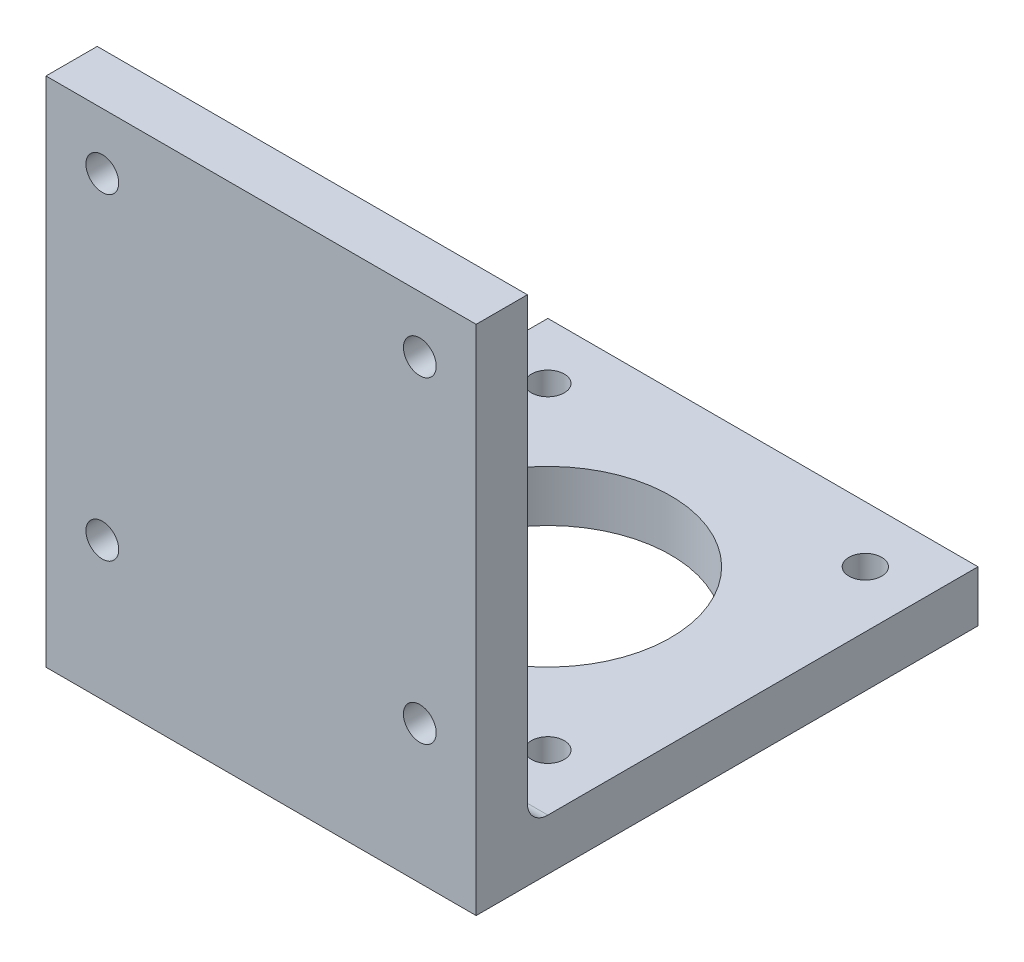
from build123d import *

# Parameters (mm, degrees)
SKETCH_1_R      = 1.6
SKETCH_1_R_2    = 12
EXTRUDE_1_DEPTH = 5
SKETCH_4_W      = 42
SKETCH_4_H      = 50
SKETCH_4_R      = 1.6
EXTRUDE_4_DEPTH = 5
FILLET_1_R      = 2


with BuildPart() as part:
    # 草图1 → 凸台-拉伸1 (new body)
    with BuildSketch(Plane(origin=(0, 0, 0), x_dir=(1, 0, 0), z_dir=(0, 1, 0))):
        Polygon((-21, -21), (-21, 21), (21, 21), (21, -21), (21, -23), (-21, -23), align=None)
        with Locations(Location((-15.5, 15.5, 0), (0, 0, 270))):
            Circle(SKETCH_1_R, mode=Mode.SUBTRACT)
        with Locations(Location((15.5, 15.5, 0), (0, 0, 270))):
            Circle(SKETCH_1_R, mode=Mode.SUBTRACT)
        with Locations(Location((-15.5, -15.5, 0), (0, 0, 270))):
            Circle(SKETCH_1_R, mode=Mode.SUBTRACT)
        with Locations(Location((15.5, -15.5, 0), (0, 0, 270))):
            Circle(SKETCH_1_R, mode=Mode.SUBTRACT)
        with Locations(Location((0, 0, 0), (0, 0, 270))):
            Circle(SKETCH_1_R_2, mode=Mode.SUBTRACT)
    extrude(amount=EXTRUDE_1_DEPTH)

    # 草图4 → 凸台-拉伸4 (add)
    with BuildSketch(Plane.XY.offset(23)):
        with Locations((0, 25)):
            Rectangle(SKETCH_4_W, SKETCH_4_H)
        with Locations((-15.5, 44.5)):
            Circle(SKETCH_4_R, mode=Mode.SUBTRACT)
        with Locations((15.5, 44.5)):
            Circle(SKETCH_4_R, mode=Mode.SUBTRACT)
        with Locations((-15.5, 13.5)):
            Circle(SKETCH_4_R, mode=Mode.SUBTRACT)
        with Locations((15.5, 13.5)):
            Circle(SKETCH_4_R, mode=Mode.SUBTRACT)
    extrude(amount=EXTRUDE_4_DEPTH)

    # 圆角1
    fillet_1_edges = [part.edges().sort_by_distance(p)[0] for p in [
        (0, 5, 23),
    ]]
    fillet(fillet_1_edges, radius=FILLET_1_R)


solid = part.part
